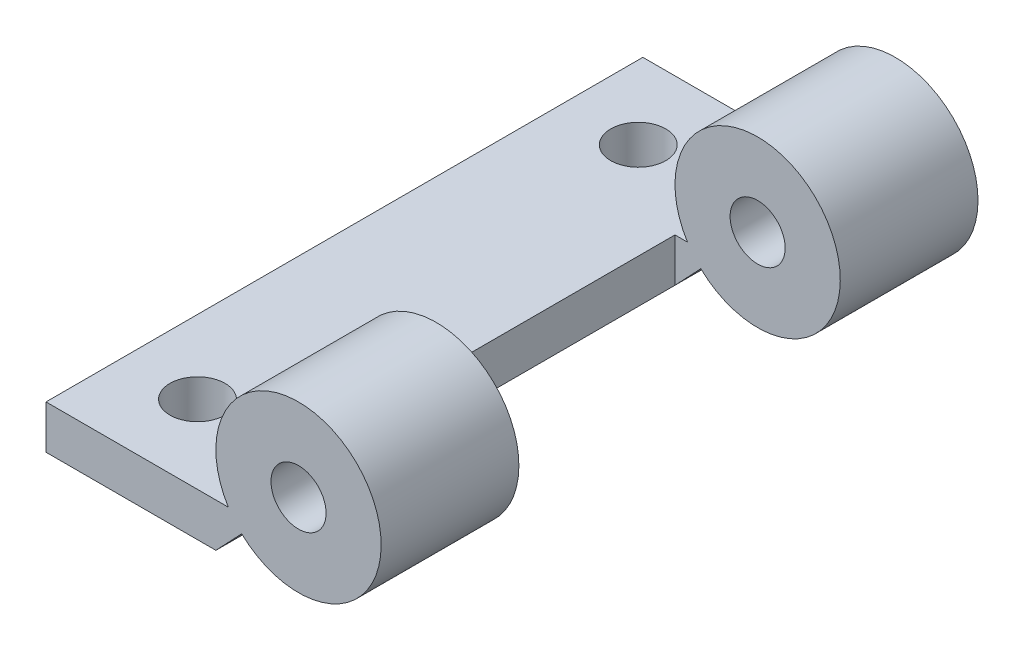
from build123d import *

# Parameters (mm, degrees)
EXTRUDE_1_DEPTH     = 65
SKETCH_2_R          = 3
CUT_EXTRUDE_1_DEPTH = 65
SKETCH_3_W          = 19.333072345
SKETCH_3_H          = 35
CUT_EXTRUDE_2_DEPTH = 32.5
SKETCH_4_R          = 3
CUT_EXTRUDE_3_DEPTH = 65


with BuildPart() as part:
    # 草图1 → 凸台-拉伸1 (new body)
    with BuildSketch(Plane.XY):
        with BuildLine():
            Line((-27.5, 4.75), (-27.5, 0))
            Line((-27.5, 0), (-9, 0))
            Line((-9, 0), (-6.189701831, 2.966425845))
            ThreePointArc((-6.189701831, 2.966425845), (6.974322263, 15.188482133), (-7.644442426, 4.75))
            Line((-7.644442426, 4.75), (-27.5, 4.75))
        make_face()
    extrude(amount=EXTRUDE_1_DEPTH)

    # 草图2 → 切除-拉伸1 (cut)
    with BuildSketch(Plane(origin=(0, 4.75, 0), x_dir=(1, 0, 0), z_dir=(0, 1, 0))):
        with Locations(Location((-19.5, -8.5, 0), (0, 0, 180))):
            Circle(SKETCH_2_R)
        with Locations(Location((-19.5, -56.5, 0), (0, 0, 270))):
            Circle(SKETCH_2_R)
    extrude(amount=-CUT_EXTRUDE_1_DEPTH, mode=Mode.SUBTRACT)

    # 草图3 → 切除-拉伸2 (cut, symmetric)
    with BuildSketch(Plane(origin=(0, 4.75, 0), x_dir=(1, 0, 0), z_dir=(0, 1, 0))):
        with Locations((0.666536173, -32.5)):
            Rectangle(SKETCH_3_W, SKETCH_3_H)
    extrude(amount=CUT_EXTRUDE_2_DEPTH, both=True, mode=Mode.SUBTRACT)

    # 草图4 → 切除-拉伸3 (cut)
    with BuildSketch(Plane.XY.offset(65)):
        with Locations((0, 9.5)):
            Circle(SKETCH_4_R)
    extrude(amount=-CUT_EXTRUDE_3_DEPTH, mode=Mode.SUBTRACT)


solid = part.part
